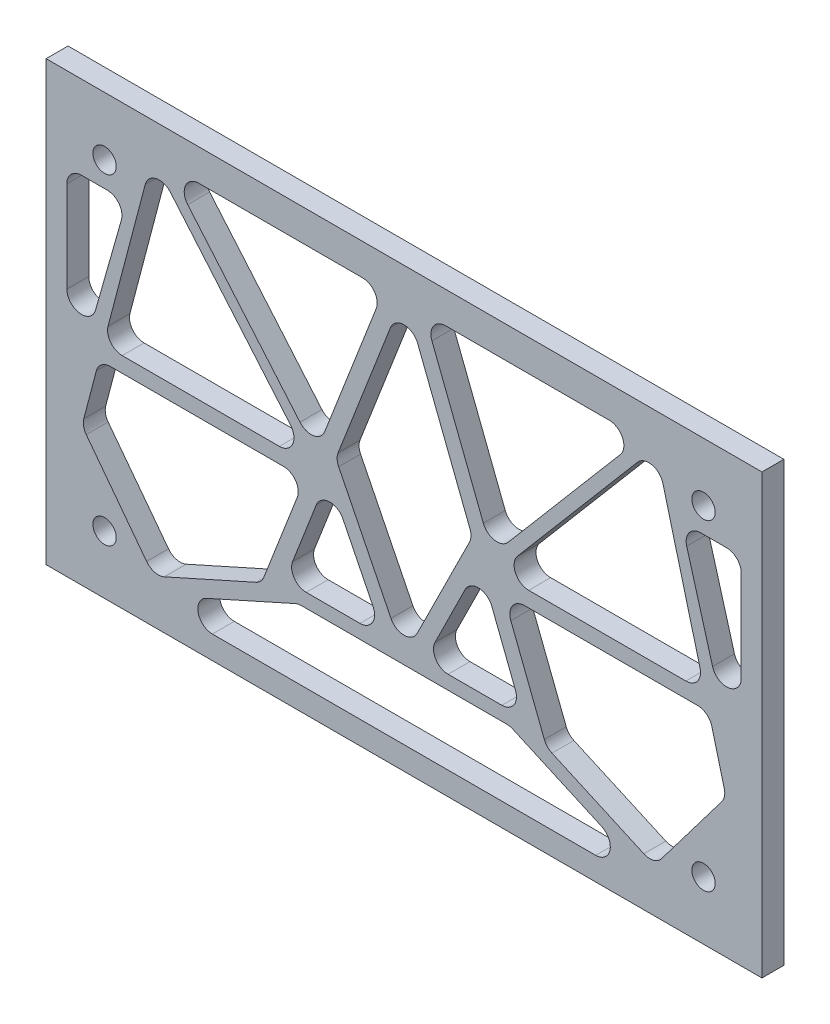
from build123d import *

# Parameters (mm, degrees)
SKETCH_1_W      = 98
SKETCH_1_H      = 60
SKETCH_1_R      = 1.6
EXTRUDE_1_DEPTH = 3
FILLET_4_R      = 2


with BuildPart() as part:
    # 草图1 → 凸台-拉伸1 (new body)
    with BuildSketch(Plane.XY):
        with Locations((49, 30)):
            Rectangle(SKETCH_1_W, SKETCH_1_H)
        with Locations((8, 8)):
            Circle(SKETCH_1_R, mode=Mode.SUBTRACT)
        with Locations(Location((90, 8, 0), (0, 0, 180))):
            Circle(SKETCH_1_R, mode=Mode.SUBTRACT)
        with Locations((90, 52)):
            Circle(SKETCH_1_R, mode=Mode.SUBTRACT)
        with Locations(Location((8, 52, 0), (0, 0, 180))):
            Circle(SKETCH_1_R, mode=Mode.SUBTRACT)
        Polygon((49, 56.461504081), (39.652852225, 32.437112926), (49, 13.645736298), (58.347147775, 32.437112926), align=None, mode=Mode.SUBTRACT)
        Polygon((32.684961024, 14.527976606), (46.19127915, 14.527976606), (38.625617, 29.796874275), align=None, mode=Mode.SUBTRACT)
        Polygon((65.315038976, 14.527976606), (59.374383, 29.796874275), (51.80872085, 14.527976606), align=None, mode=Mode.SUBTRACT)
        Polygon((51.754435798, 55.675997791), (61.074674823, 31.720768521), (81.417430018, 55.675997791), align=None, mode=Mode.SUBTRACT)
        Polygon((83.46136082, 55.573734568), (61.744172649, 30), (90.184817286, 30), align=None, mode=Mode.SUBTRACT)
        Polygon((62.560585094, 27.901625993), (68.503620332, 12.626613057), (83.282124763, 5.998312223), (93.091894324, 18.94247075), (90.736489794, 27.901625993), align=None, mode=Mode.SUBTRACT)
        Polygon((34.516229814, 12.626613057), (63.483770186, 12.626613057), (84.583930387, 3.16298904), (13.416069613, 3.16298904), align=None, mode=Mode.SUBTRACT)
        Polygon((14.717875237, 5.998312223), (4.908105676, 18.94247075), (7.263510206, 27.901625993), (35.439414906, 27.901625993), (29.496379668, 12.626613057), align=None, mode=Mode.SUBTRACT)
        Polygon((14.53863918, 55.573734568), (36.255827351, 30), (7.815182714, 30), align=None, mode=Mode.SUBTRACT)
        Polygon((36.925325177, 31.720768521), (16.582569982, 55.675997791), (46.245564202, 55.675997791), align=None, mode=Mode.SUBTRACT)
        Polygon((2.839889493, 48.591962143), (11.02417284, 48.591962143), (2.839889493, 19.702141439), align=None, mode=Mode.SUBTRACT)
        Polygon((86.97582716, 48.591962143), (95.160110507, 19.702141439), (95.160110507, 48.591962143), align=None, mode=Mode.SUBTRACT)
    extrude(amount=EXTRUDE_1_DEPTH)

    # 圆角4
    fillet_4_edges = [part.edges().sort_by_distance(p)[0] for p in [
        (90.736489794, 27.901625993, 1.5),
        (62.560585094, 27.901625993, 1.5),
        (2.839889493, 48.591962143, 1.5),
        (2.839889493, 19.702141439, 1.5),
        (11.02417284, 48.591962143, 1.5),
        (95.160110507, 48.591962143, 1.5),
        (86.97582716, 48.591962143, 1.5),
        (95.160110507, 19.702141439, 1.5),
        (35.439414906, 27.901625993, 1.5),
        (7.263510206, 27.901625993, 1.5),
        (4.908105676, 18.94247075, 1.5),
        (14.717875237, 5.998312223, 1.5),
        (29.496379668, 12.626613057, 1.5),
        (14.53863918, 55.573734568, 1.5),
        (7.815182714, 30, 1.5),
        (36.255827351, 30, 1.5),
        (36.925325177, 31.720768521, 1.5),
        (46.245564202, 55.675997791, 1.5),
        (16.582569982, 55.675997791, 1.5),
        (58.347147775, 32.437112926, 1.5),
        (49, 56.461504081, 1.5),
        (39.652852225, 32.437112926, 1.5),
        (49, 13.645736298, 1.5),
        (38.625617, 29.796874275, 1.5),
        (32.684961024, 14.527976606, 1.5),
        (46.19127915, 14.527976606, 1.5),
        (81.417430018, 55.675997791, 1.5),
        (51.754435798, 55.675997791, 1.5),
        (61.074674823, 31.720768521, 1.5),
        (51.80872085, 14.527976606, 1.5),
        (65.315038976, 14.527976606, 1.5),
        (59.374383, 29.796874275, 1.5),
        (90.184817286, 30, 1.5),
        (83.46136082, 55.573734568, 1.5),
        (61.744172649, 30, 1.5),
        (34.516229814, 12.626613057, 1.5),
        (13.416069613, 3.16298904, 1.5),
        (84.583930387, 3.16298904, 1.5),
        (63.483770186, 12.626613057, 1.5),
        (68.503620332, 12.626613057, 1.5),
        (83.282124763, 5.998312223, 1.5),
        (93.091894324, 18.94247075, 1.5),
    ]]
    fillet(fillet_4_edges, radius=FILLET_4_R)


solid = part.part
